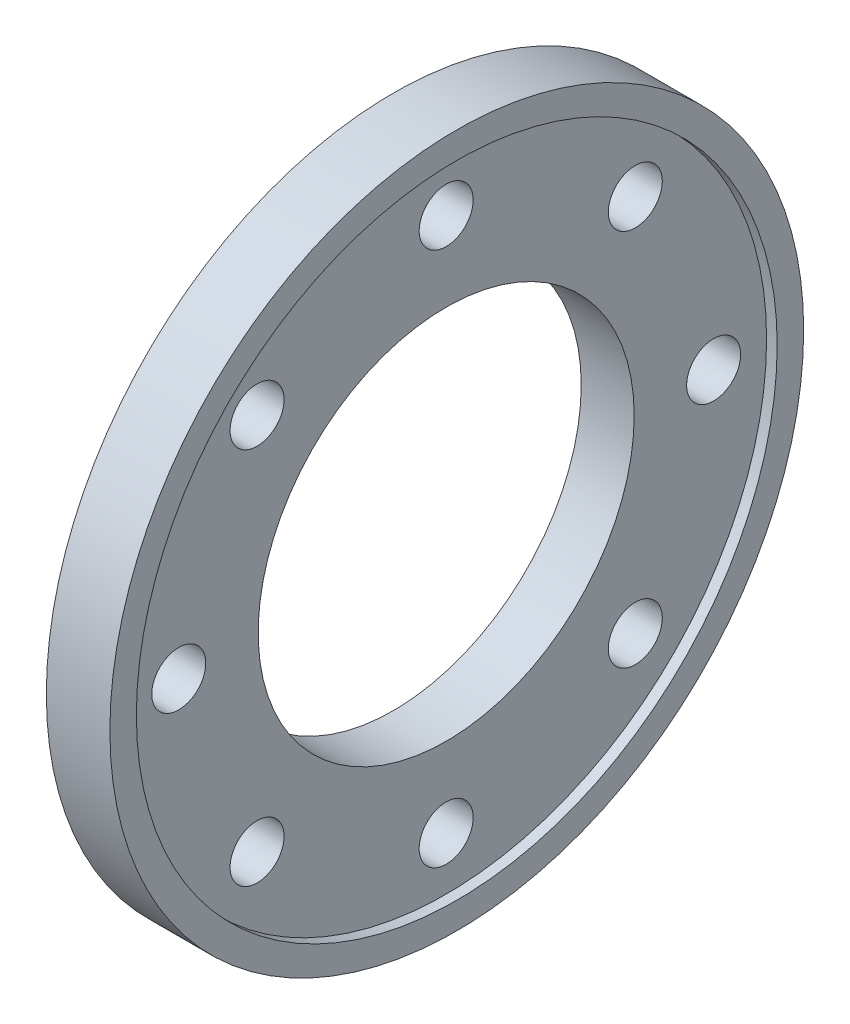
from build123d import *

# Parameters (mm, degrees)
SKETCH_1_R           = 65.5
SKETCH_1_R_2         = 35.5
SKETCH_1_R_3         = 5.1
EXTRUDE_1_DEPTH      = 6
SKETCH_2_OUTSIDE_W   = 170.13
SKETCH_2_OUTSIDE_H   = 170.13
SKETCH_2_OUTSIDE_R   = 65.5
SKETCH_2_OUTSIDE_R_2 = 60.5
CUT_EXTRUDE_1_DEPTH  = 2


with BuildPart() as part:
    # Эскиз1 → Бобышка-Вытянуть1 (new, symmetric)
    with BuildSketch(Plane(origin=(0, 0, 0), x_dir=(0, 0, -1), z_dir=(1, 0, 0))):
        Circle(SKETCH_1_R)
        Circle(SKETCH_1_R_2, mode=Mode.SUBTRACT)
        with Locations((0, 50.5)):
            Circle(SKETCH_1_R_3, mode=Mode.SUBTRACT)
        with Locations((35.70889245, 35.70889245)):
            Circle(SKETCH_1_R_3, mode=Mode.SUBTRACT)
        with Locations((50.5, 0)):
            Circle(SKETCH_1_R_3, mode=Mode.SUBTRACT)
        with Locations((35.70889245, -35.70889245)):
            Circle(SKETCH_1_R_3, mode=Mode.SUBTRACT)
        with Locations((0, -50.5)):
            Circle(SKETCH_1_R_3, mode=Mode.SUBTRACT)
        with Locations((-35.70889245, -35.70889245)):
            Circle(SKETCH_1_R_3, mode=Mode.SUBTRACT)
        with Locations((-50.5, 0)):
            Circle(SKETCH_1_R_3, mode=Mode.SUBTRACT)
        with Locations((-35.70889245, 35.70889245)):
            Circle(SKETCH_1_R_3, mode=Mode.SUBTRACT)
    extrude(amount=EXTRUDE_1_DEPTH, both=True)

    # Эскиз2 outside → Вырез-Вытянуть1 (cut)
    # profile 1 of 2: a face of its own
    with BuildSketch(Plane(origin=(6, 0, 0), x_dir=(0, 0, -1), z_dir=(1, 0, 0))):
        Rectangle(SKETCH_2_OUTSIDE_W, SKETCH_2_OUTSIDE_H)
        Circle(SKETCH_2_OUTSIDE_R, mode=Mode.SUBTRACT)
    # profile 2 of 2: a face of its own
    with BuildSketch(Plane(origin=(6, 0, 0), x_dir=(0, 0, -1), z_dir=(1, 0, 0))):
        Circle(SKETCH_2_OUTSIDE_R_2)
    extrude(amount=-CUT_EXTRUDE_1_DEPTH, mode=Mode.SUBTRACT)


solid = part.part
